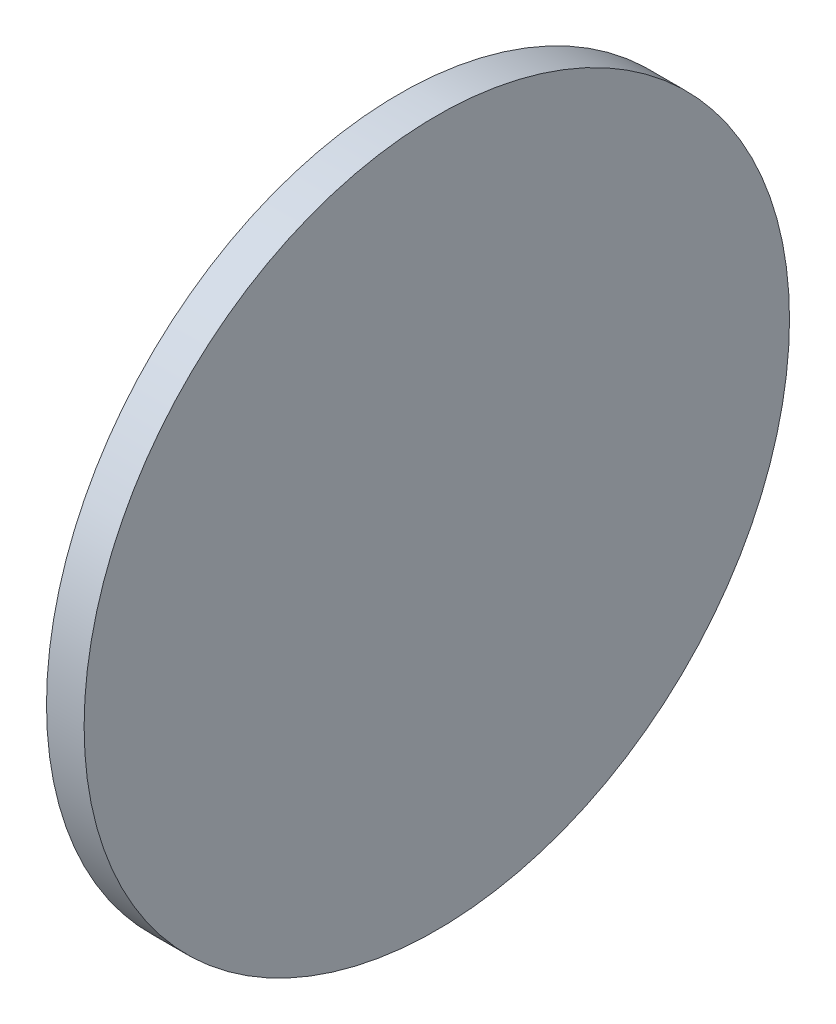
from build123d import *

# Parameters (mm, degrees)
SKETCH_1_R          = 12.5
SKETCH_1_R_2        = 1.75
EXTRUDE_1_DEPTH     = 5
FILLET_1_R          = 5
SKETCH_3_R          = 1.1
CUT_EXTRUDE_2_DEPTH = 10
SKETCH_4_R          = 1.5
CUT_EXTRUDE_3_DEPTH = 10
EXTRUDE1_DEPTH      = 311.885831134
SKETCH2_R           = 75
EXTRUDE2_DEPTH      = 3


with BuildPart() as part:
    # 草图1 → 凸台-拉伸1 (new body)
    with BuildSketch(Plane(origin=(0, 0, 0), x_dir=(0, 0, -1), z_dir=(1, 0, 0))):
        with BuildLine():
            Line((0, 0), (0, 160))
            ThreePointArc((0, 160), (60, 280), (120, 160))
            Line((120, 160), (120, 0))
            Line((120, 0), (0, 0))
        make_face()
        with Locations((60, 205)):
            Circle(SKETCH_1_R, mode=Mode.SUBTRACT)
        with Locations((25, 177)):
            Circle(SKETCH_1_R_2, mode=Mode.SUBTRACT)
        with Locations((32, 170)):
            Circle(SKETCH_1_R_2, mode=Mode.SUBTRACT)
        with Locations((25, 163)):
            Circle(SKETCH_1_R_2, mode=Mode.SUBTRACT)
        with Locations((18, 170)):
            Circle(SKETCH_1_R_2, mode=Mode.SUBTRACT)
        with Locations((95, 177)):
            Circle(SKETCH_1_R_2, mode=Mode.SUBTRACT)
        with Locations((102, 170)):
            Circle(SKETCH_1_R_2, mode=Mode.SUBTRACT)
        with Locations((95, 163)):
            Circle(SKETCH_1_R_2, mode=Mode.SUBTRACT)
        with Locations((88, 170)):
            Circle(SKETCH_1_R_2, mode=Mode.SUBTRACT)
        with Locations((39, 140)):
            Circle(SKETCH_1_R_2, mode=Mode.SUBTRACT)
        with Locations((81, 140)):
            Circle(SKETCH_1_R_2, mode=Mode.SUBTRACT)
        with Locations((60, 275)):
            Circle(SKETCH_1_R_2, mode=Mode.SUBTRACT)
        with Locations((-10, 205)):
            Circle(SKETCH_1_R_2, mode=Mode.SUBTRACT)
        with Locations((130, 205)):
            Circle(SKETCH_1_R_2, mode=Mode.SUBTRACT)
        with Locations((10.502525317, 254.497474683)):
            Circle(SKETCH_1_R_2, mode=Mode.SUBTRACT)
        with Locations((109.497474683, 254.497474683)):
            Circle(SKETCH_1_R_2, mode=Mode.SUBTRACT)
        with Locations((5, 5)):
            Circle(SKETCH_1_R_2, mode=Mode.SUBTRACT)
        with Locations((115, 5)):
            Circle(SKETCH_1_R_2, mode=Mode.SUBTRACT)
        with Locations((5, 120)):
            Circle(SKETCH_1_R_2, mode=Mode.SUBTRACT)
        with Locations((115, 120)):
            Circle(SKETCH_1_R_2, mode=Mode.SUBTRACT)
        with BuildLine():
            Line((40.5, 81), (40.5, 59))
            ThreePointArc((40.5, 59), (39, 57.5), (37.5, 59))
            Line((37.5, 59), (37.5, 81))
            ThreePointArc((37.5, 81), (39, 82.5), (40.5, 81))
        make_face(mode=Mode.SUBTRACT)
        with BuildLine():
            Line((79.5, 81), (79.5, 59))
            ThreePointArc((79.5, 59), (81, 57.5), (82.5, 59))
            Line((82.5, 59), (82.5, 81))
            ThreePointArc((82.5, 81), (81, 82.5), (79.5, 81))
        make_face(mode=Mode.SUBTRACT)
    extrude(amount=EXTRUDE_1_DEPTH)

    # 圆角1
    fillet_1_edges = [part.edges().sort_by_distance(p)[0] for p in [
        (2.5, 0, 0),
        (2.5, 160, 0),
        (2.5, 160, -120),
        (2.5, 0, -120),
    ]]
    fillet(fillet_1_edges, radius=FILLET_1_R)

    # 草图3 → 切除-拉伸2 (cut)
    with BuildSketch(Plane.ZY):
        with Locations((-45.818141739, 127.45827935)):
            Circle(SKETCH_3_R)
        with Locations((-61.818141739, 127.45827935)):
            Circle(SKETCH_3_R)
        with Locations((-45.818141739, 91.45827935)):
            Circle(SKETCH_3_R)
        with Locations((-61.818141739, 91.45827935)):
            Circle(SKETCH_3_R)
        with BuildLine():
            Line((-20, 46.75), (-30, 46.75))
            ThreePointArc((-30, 46.75), (-31.75, 48.5), (-30, 50.25))
            Line((-30, 50.25), (-20, 50.25))
            ThreePointArc((-20, 50.25), (-18.25, 48.5), (-20, 46.75))
        make_face()
        with BuildLine():
            Line((-90, 46.75), (-100, 46.75))
            ThreePointArc((-100, 46.75), (-101.75, 48.5), (-100, 50.25))
            Line((-100, 50.25), (-90, 50.25))
            ThreePointArc((-90, 50.25), (-88.25, 48.5), (-90, 46.75))
        make_face()
        with BuildLine():
            Line((-20, 8.25), (-30, 8.25))
            ThreePointArc((-30, 8.25), (-31.75, 10), (-30, 11.75))
            Line((-30, 11.75), (-20, 11.75))
            ThreePointArc((-20, 11.75), (-18.25, 10), (-20, 8.25))
        make_face()
        with BuildLine():
            Line((-90, 8.25), (-100, 8.25))
            ThreePointArc((-100, 8.25), (-101.75, 10), (-100, 11.75))
            Line((-100, 11.75), (-90, 11.75))
            ThreePointArc((-90, 11.75), (-88.25, 10), (-90, 8.25))
        make_face()
    extrude(amount=-CUT_EXTRUDE_2_DEPTH, mode=Mode.SUBTRACT)

    # 草图4 → 切除-拉伸3 (cut)
    with BuildSketch(Plane.ZY):
        with Locations((-16.118918229, 88.740617872)):
            Circle(SKETCH_4_R)
        with Locations((-16.118918229, 64.240617872)):
            Circle(SKETCH_4_R)
        with Locations((-94, 140)):
            Circle(SKETCH_4_R)
        with Locations((-26, 140)):
            Circle(SKETCH_4_R)
        with Locations((-94, 82)):
            Circle(SKETCH_4_R)
        with Locations((-26, 82)):
            Circle(SKETCH_4_R)
    extrude(amount=-CUT_EXTRUDE_3_DEPTH, mode=Mode.SUBTRACT)

    # Sketch1 → Extrude1 (cut, through all)
    with BuildSketch(Plane.ZY):
        with BuildLine():
            Line((0.9375, 161.277910689), (0.9375, -17.17747431))
            Line((0.9375, -17.17747431), (-120, -17.17747431))
            Line((-120, -17.17747431), (-120.9375, 161.277910689))
            ThreePointArc((-120.9375, 161.277910689), (-60, 130), (0.9375, 161.277910689))
        make_face()
    extrude(amount=-EXTRUDE1_DEPTH, mode=Mode.SUBTRACT)

    # Sketch2 → Extrude2 (add)
    with BuildSketch(Plane(origin=(5, 0, 0), x_dir=(0, 0, -1), z_dir=(1, 0, 0))):
        with Locations(Location((60, 205, 0), (0, 0, 180))):
            Circle(SKETCH2_R)
    extrude(amount=EXTRUDE2_DEPTH)


solid = part.part
